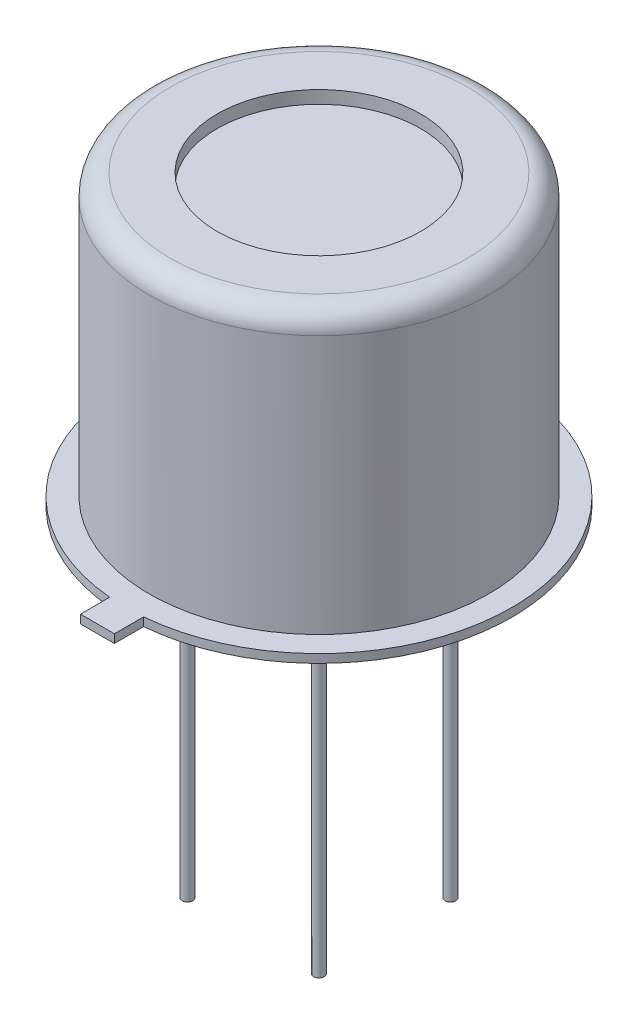
from build123d import *

# Parameters (mm, degrees)
SKETCH_1_R          = 4
EXTRUDE_1_DEPTH     = 6.6
SKETCH_2_R          = 4.55
EXTRUDE_2_DEPTH     = 0.2
SKETCH_5_W          = 0.8
SKETCH_5_H          = 0.992889455
EXTRUDE_4_DEPTH     = 0.2
SKETCH_4_R          = 2.4
CUT_EXTRUDE_1_DEPTH = 0.3
FILLET_1_R          = 0.5
SKETCH_3_R          = 0.125
EXTRUDE_3_DEPTH     = 8


with BuildPart() as part:
    # 草图1 → 凸台-拉伸1 (new body)
    with BuildSketch(Plane(origin=(0, 0, 0), x_dir=(1, 0, 0), z_dir=(0, 1, 0))):
        with Locations(Location((0, 0, 0), (0, 0, 270))):
            Circle(SKETCH_1_R)
    extrude(amount=EXTRUDE_1_DEPTH)

    # 草图2 → 凸台-拉伸2 (add)
    with BuildSketch(Plane.XZ):
        with Locations(Location((0, 0, 0), (0, 0, 270))):
            Circle(SKETCH_2_R)
    extrude(amount=EXTRUDE_2_DEPTH)

    # 草图5 → 凸台-拉伸4 (add)
    with BuildSketch(Plane.XZ.offset(0.2)):
        with Locations((0, 4.725827174)):
            Rectangle(SKETCH_5_W, SKETCH_5_H)
    extrude(amount=-EXTRUDE_4_DEPTH)

    # 草图4 → 切除-拉伸1 (cut)
    with BuildSketch(Plane(origin=(0, 6.6, 0), x_dir=(1, 0, 0), z_dir=(0, 1, 0))):
        with Locations(Location((0, 0, 0), (0, 0, 270))):
            Circle(SKETCH_4_R)
    extrude(amount=-CUT_EXTRUDE_1_DEPTH, mode=Mode.SUBTRACT)

    # 圆角1
    fillet_1_edges = [part.edges().sort_by_distance(p)[0] for p in [
        (0, 6.6, -4),
    ]]
    fillet(fillet_1_edges, radius=FILLET_1_R)

    # 草图3 → 凸台-拉伸3 (add)
    with BuildSketch(Plane.XZ.offset(0.2)):
        with Locations(Location((-1.55, 1.55, 0), (0, 0, 270))):
            Circle(SKETCH_3_R)
        with Locations(Location((1.55, 1.55, 0), (0, 0, 90))):
            Circle(SKETCH_3_R)
        with Locations(Location((1.55, -1.55, 0), (0, 0, 270))):
            Circle(SKETCH_3_R)
        with Locations(Location((-1.55, -1.55, 0), (0, 0, 90))):
            Circle(SKETCH_3_R)
    extrude(amount=EXTRUDE_3_DEPTH)


solid = part.part
